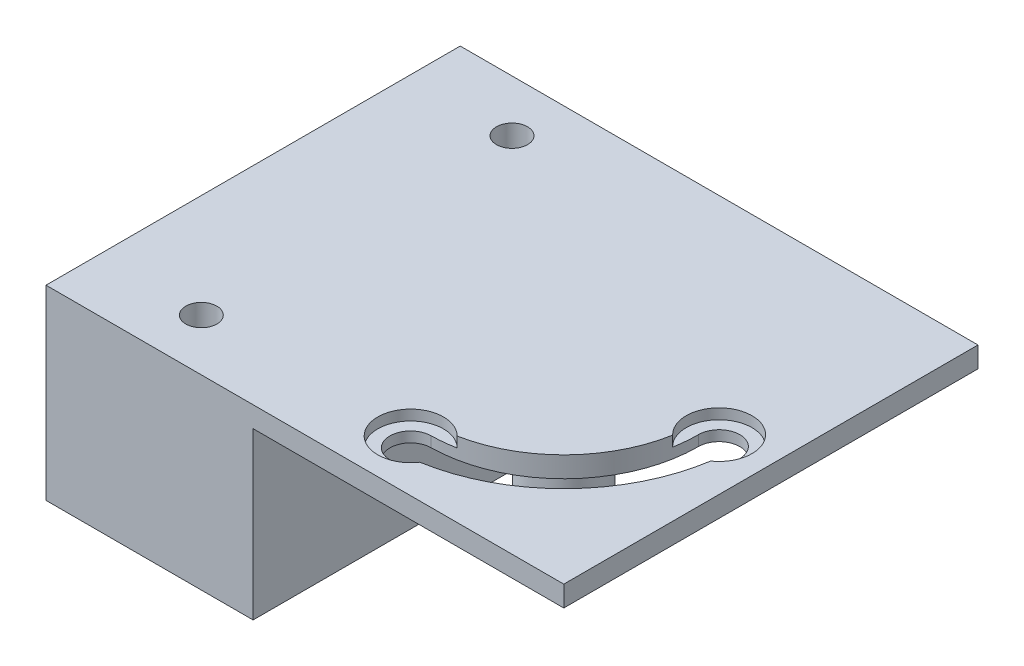
from build123d import *

# Parameters (mm, degrees)
SKETCH1_W             = 60
SKETCH1_H             = 40
BOSS_EXTRUDE1_DEPTH   = 2
CUT_EXTRUDE1_DEPTH    = 14
SKETCH6_W             = 30
SKETCH6_H             = 40
BOSS_EXTRUDE4_DEPTH   = 16
SKETCH8_R             = 3.5
BOSS_EXTRUDE5_DEPTH   = 16
SKETCH9_R             = 3.175
CUT_EXTRUDE2_DEPTH    = 1
SKETCH10_W            = 10
SKETCH10_H            = 40
CUT_EXTRUDE3_DEPTH    = 30
F_3_0MM_DOWEL_HOLE1_D = 3


with BuildPart() as part:
    # Sketch1 → Boss-Extrude1 (new body)
    with BuildSketch(Plane(origin=(0, 0, 0), x_dir=(1, 0, 0), z_dir=(0, 1, 0))):
        Rectangle(SKETCH1_W, SKETCH1_H)
    extrude(amount=BOSS_EXTRUDE1_DEPTH)

    # Sketch4 → Cut-Extrude1 (cut)
    with BuildSketch(Plane(origin=(0, 2, 0), x_dir=(1, 0, 0), z_dir=(0, 1, 0))):
        with BuildLine():
            ThreePointArc((27, 0), (22.104938303, -11.936099391), (10.23876839, -16.998323142))
            ThreePointArc((10.23876839, -16.998323142), (8.210875269, -15.026610819), (10.182587592, -12.998717697))
            ThreePointArc((10.182587592, -12.998717697), (19.256717526, -9.127605417), (23, 0))
            ThreePointArc((23, 0), (25, 2), (27, 0))
        make_face()
    extrude(amount=-CUT_EXTRUDE1_DEPTH, mode=Mode.SUBTRACT)

    # Sketch6 → Boss-Extrude4 (add)
    with BuildSketch(Plane.XZ):
        with Locations((-15, 0)):
            Rectangle(SKETCH6_W, SKETCH6_H)
    extrude(amount=BOSS_EXTRUDE4_DEPTH)

    # Sketch8 → Boss-Extrude5 (add)
    with BuildSketch(Plane.XZ):
        with Locations(Location((10, 0, 0), (0, 0, 90))):
            Circle(SKETCH8_R)
    extrude(amount=BOSS_EXTRUDE5_DEPTH)

    # Sketch9 → Cut-Extrude2 (cut)
    with BuildSketch(Plane(origin=(0, 2, 0), x_dir=(1, 0, 0), z_dir=(0, 1, 0))):
        with Locations((25, 0)):
            Circle(SKETCH9_R)
        with Locations((10.210677991, -14.99852042)):
            Circle(SKETCH9_R)
    extrude(amount=-CUT_EXTRUDE2_DEPTH, mode=Mode.SUBTRACT)

    # Sketch10 → Cut-Extrude3 (cut)
    with BuildSketch(Plane(origin=(0, 2, 0), x_dir=(1, 0, 0), z_dir=(0, 1, 0))):
        with Locations((-25, 0)):
            Rectangle(SKETCH10_W, SKETCH10_H)
    extrude(amount=-CUT_EXTRUDE3_DEPTH, mode=Mode.SUBTRACT)

    # Ø3.0mm Dowel Hole1 (through all)
    with Locations(Plane(origin=(0, 2, 0), x_dir=(1, 0, 0), z_dir=(0, 1, 0))):
        with Locations((-10, 15), (-10, -15)):
            Hole(F_3_0MM_DOWEL_HOLE1_D / 2)


solid = part.part
